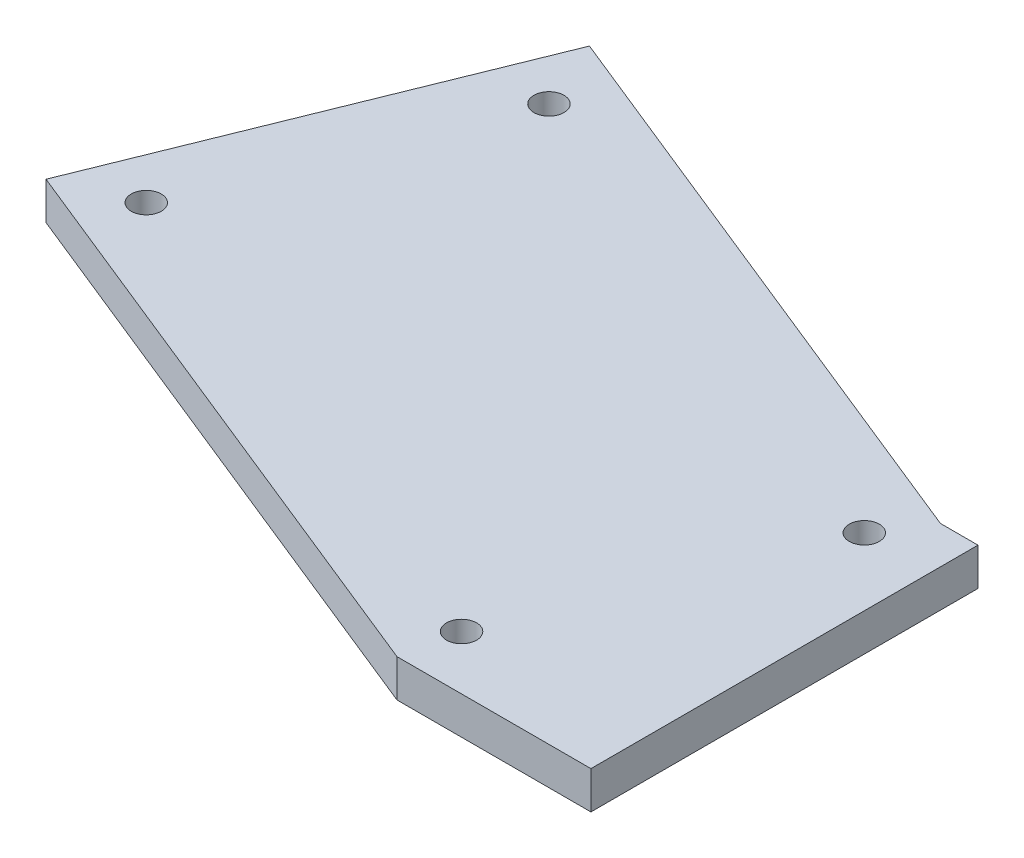
from build123d import *

# Parameters (mm, degrees)
SKETCH1_R           = 1.27
BOSS_EXTRUDE1_DEPTH = 3.175


with BuildPart() as part:
    # Sketch1 → Boss-Extrude1 (new body)
    with BuildSketch(Plane(origin=(0, 0, 0), x_dir=(1, 0, 0), z_dir=(0, 1, 0))):
        Polygon((0, 0), (-3.175, 0), (-52.983971976, 20.12413096), (-66.209832363, -12.611022209), (-16.400860387, -32.735153169), (0, -32.735153169), align=None)
        with Locations(Location((-50.457588738, 14.172345032, 0), (0, 0, 270))):
            Circle(SKETCH1_R, mode=Mode.SUBTRACT)
        with Locations(Location((-60.258046435, -10.084638971, 0), (0, 0, 270))):
            Circle(SKETCH1_R, mode=Mode.SUBTRACT)
        with Locations(Location((-15.512153614, -28.163153169, 0), (0, 0, 270))):
            Circle(SKETCH1_R, mode=Mode.SUBTRACT)
        with Locations(Location((-5.711695917, -3.906169166, 0), (0, 0, 270))):
            Circle(SKETCH1_R, mode=Mode.SUBTRACT)
    extrude(amount=BOSS_EXTRUDE1_DEPTH)


solid = part.part
